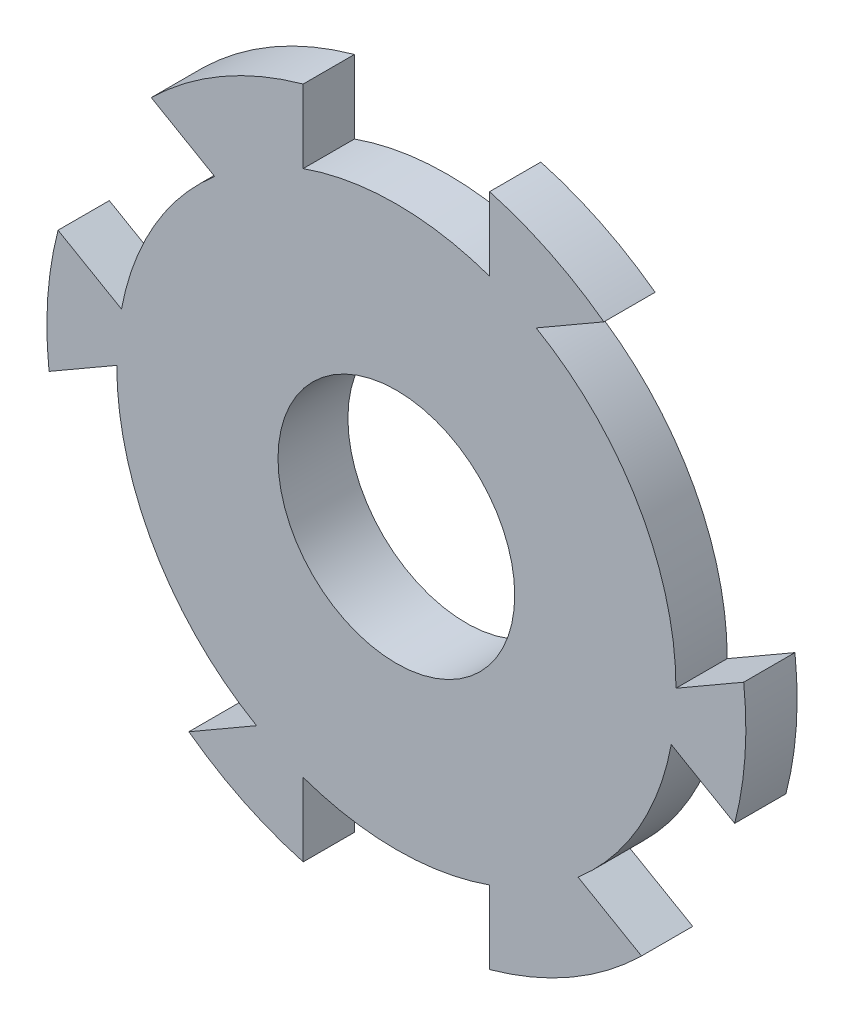
from build123d import *
from build123d.topology import SkipClean

# Parameters (mm, degrees)
SKETCH1_R      = 3.2258
EXTRUDE1_DEPTH = 1.397
EXTRUDE2_START = 0.508
SKETCH2_R      = 4.7625
SKETCH2_R_2    = 3.2258
EXTRUDE2_DEPTH = 0.508


with BuildPart() as part:
    # Sketch1 → Extrude1 (new body)
    with BuildSketch(Plane.XY):
        with BuildLine():
            Line((-7.491703947, 1.392397923), (-9.220189856, 2.390339728))
            ThreePointArc((-9.220189856, 2.390339728), (-9.501142646, 0.673730975), (-9.465234371, -1.065346561))
            Line((-9.465234371, -1.065346561), (-7.62, 0))
            ThreePointArc((-7.62, 0), (-6.599113577, -3.81), (-3.81, -6.599113577))
            Line((-3.81, -6.599113577), (-5.655234371, -7.664460138))
            ThreePointArc((-5.655234371, -7.664460138), (-4.167103183, -8.565096384), (-2.54, -9.180088507))
            Line((-2.54, -9.180088507), (-2.54, -7.184204897))
            ThreePointArc((-2.54, -7.184204897), (0, -7.62), (2.54, -7.184204897))
            Line((2.54, -7.184204897), (2.54, -9.180088507))
            ThreePointArc((2.54, -9.180088507), (4.7625, -8.248891971), (6.680189856, -6.789748779))
            Line((6.680189856, -6.789748779), (4.951703947, -5.791806974))
            ThreePointArc((4.951703947, -5.791806974), (6.599113577, -3.81), (7.491703947, -1.392397923))
            Line((7.491703947, -1.392397923), (9.220189856, -2.390339728))
            ThreePointArc((9.220189856, -2.390339728), (9.501142646, -0.673730975), (9.465234371, 1.065346561))
            Line((9.465234371, 1.065346561), (7.62, 0))
            ThreePointArc((7.62, 0), (6.599113577, 3.81), (3.81, 6.599113577))
            Line((3.81, 6.599113577), (5.655234371, 7.664460138))
            ThreePointArc((5.655234371, 7.664460138), (4.167103183, 8.565096384), (2.54, 9.180088507))
            Line((2.54, 9.180088507), (2.54, 7.184204897))
            ThreePointArc((2.54, 7.184204897), (0, 7.62), (-2.54, 7.184204897))
            Line((-2.54, 7.184204897), (-2.54, 9.180088507))
            ThreePointArc((-2.54, 9.180088507), (-4.7625, 8.248891971), (-6.680189856, 6.789748779))
            Line((-6.680189856, 6.789748779), (-4.951703947, 5.791806974))
            ThreePointArc((-4.951703947, 5.791806974), (-6.599113577, 3.81), (-7.491703947, 1.392397923))
        make_face()
        Circle(SKETCH1_R, mode=Mode.SUBTRACT)
    extrude(amount=EXTRUDE1_DEPTH)

    # Sketch2 → Extrude2 (add)
    with SkipClean():  # the faces are left unmerged after this step: merging them gives an invalid solid
        with BuildSketch(Plane(origin=(0, 0, 0), x_dir=(-1, 0, 0), z_dir=(0, 0, -1)).offset(EXTRUDE2_START)):
            with Locations(Location((0, 0, 0), (0, 0, 180))):
                Circle(SKETCH2_R)
            Circle(SKETCH2_R_2, mode=Mode.SUBTRACT)
        extrude(amount=-EXTRUDE2_DEPTH)


solid = part.part
